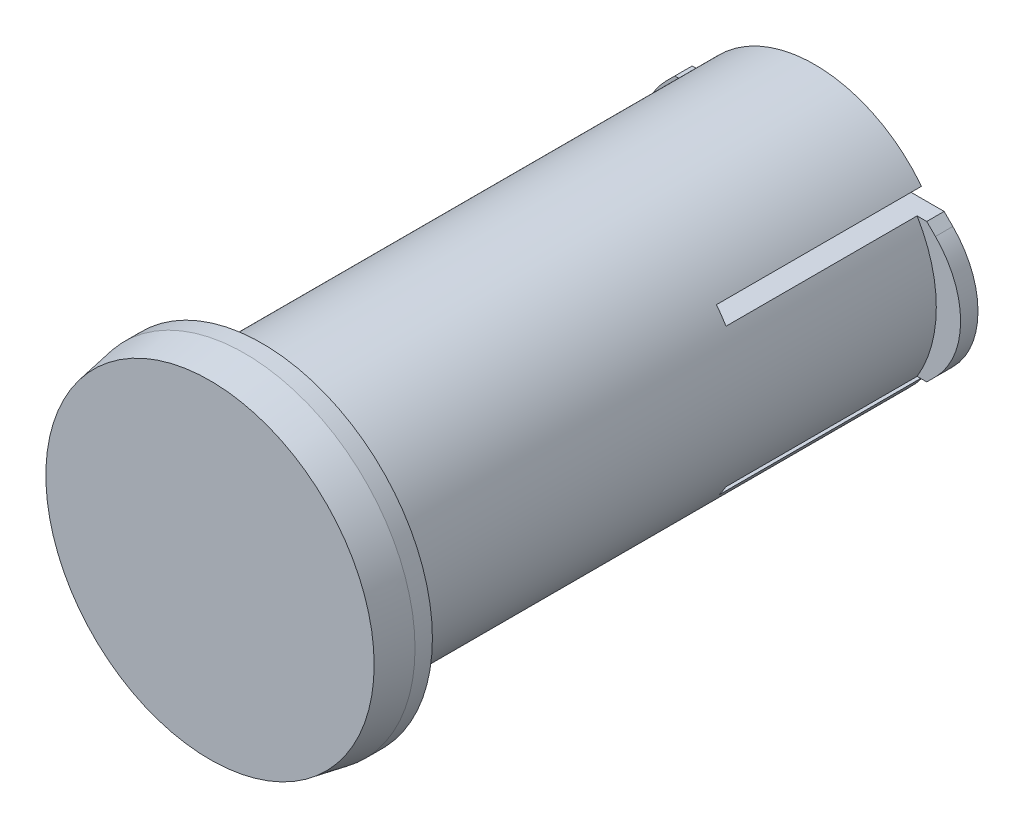
from build123d import *

# Parameters (mm, degrees)
SKETCH1_R           = 3.9
BOSS_EXTRUDE1_DEPTH = 16
SKETCH1_3_R         = 4.9
BOSS_EXTRUDE2_DEPTH = 1.5
CUT_EXTRUDE2_START  = 15.9
SKETCH5_R           = 3.9
SKETCH5_R_2         = 2
CUT_EXTRUDE2_DEPTH  = 3.2
CHAMFER1_SIZE       = 1
CHAMFER1_SIZE2      = 0.176326981
BOSS_EXTRUDE3_DEPTH = 0.5
CUT_EXTRUDE1_DEPTH  = 6


with BuildPart() as part:
    # Sketch1 → Boss-Extrude1 (new body)
    with BuildSketch(Plane.XY):
        Circle(SKETCH1_R)
    extrude(amount=-BOSS_EXTRUDE1_DEPTH)

    # Sketch1<3> → Boss-Extrude2 (add)
    with BuildSketch(Plane.XY):
        Circle(SKETCH1_3_R)
    extrude(amount=BOSS_EXTRUDE2_DEPTH)

    # Sketch5 → Cut-Extrude2 (cut)
    with BuildSketch(Plane(origin=(0, 0, 0), x_dir=(-1, 0, 0), z_dir=(0, 0, -1)).offset(CUT_EXTRUDE2_START)):
        Circle(SKETCH5_R)
        Circle(SKETCH5_R_2, mode=Mode.SUBTRACT)
    extrude(amount=CUT_EXTRUDE2_DEPTH, mode=Mode.SUBTRACT)

    # Chamfer1
    chamfer1_edges = [part.edges().sort_by_distance(p)[0] for p in [
        (-4.9, 0, 1.5),
    ]]
    chamfer1_side = [part.faces().sort_by_distance(p)[0] for p in [
        (-4.9, 0, 0.75),
    ]]
    chamfer(chamfer1_edges, length=CHAMFER1_SIZE, length2=CHAMFER1_SIZE2, reference=chamfer1_side[0])

    # Sketch2 → Boss-Extrude3 (add)
    with BuildSketch(Plane(origin=(0, 0, -16), x_dir=(-1, 0, 0), z_dir=(0, 0, -1))):
        with BuildLine():
            Line((-3.625126266, 2), (-2.1, 2))
            Line((-2.1, 2), (-2.1, -2))
            Line((-2.1, -2), (-3.625126266, -2))
            Line((-3.625126266, -2), (-3.875126266, -1.75))
            ThreePointArc((-3.875126266, -1.75), (-4.6, 0), (-3.875126266, 1.75))
            Line((-3.875126266, 1.75), (-3.625126266, 2))
        make_face()
    boss_extrude3 = extrude(amount=-BOSS_EXTRUDE3_DEPTH)

    # Sketch4 → Cut-Extrude1 (cut)
    with BuildSketch(Plane(origin=(0, 0, -16), x_dir=(-1, 0, 0), z_dir=(0, 0, -1))):
        Polygon((-3.625126266, -2), (-2.1, -2), (-2.1, 2), (-3.625126266, 2), (-3.625126266, 2.4), (-1.2, 2.4), (-1.2, -2.3), (-3.625126266, -2.3), align=None)
    cut_extrude1 = extrude(amount=-CUT_EXTRUDE1_DEPTH, mode=Mode.SUBTRACT)

    # Mirror1: Boss-Extrude3, Cut-Extrude1 across plane
    add(boss_extrude3.mirror(Plane(origin=(0, 0, 0), x_dir=(0, 0, 1), z_dir=(1, 0, 0))))
    add(cut_extrude1.mirror(Plane(origin=(0, 0, 0), x_dir=(0, 0, 1), z_dir=(1, 0, 0))), mode=Mode.SUBTRACT)


solid = part.part
